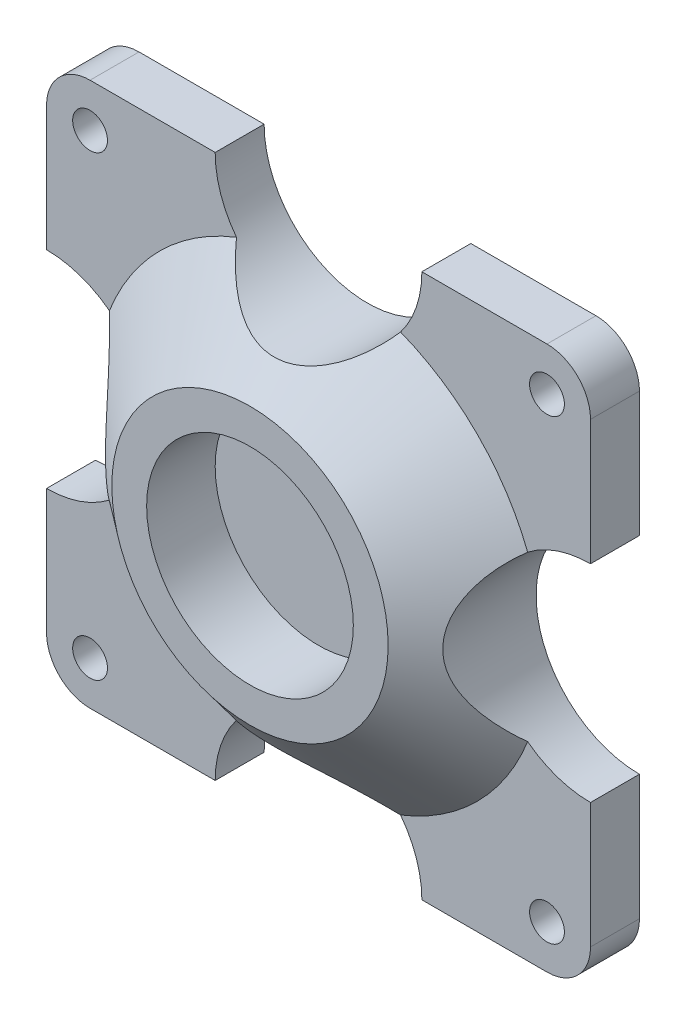
from build123d import *

# Parameters (mm, degrees)
BOSS_EXTRUDE1_DEPTH     = 4.5
SKETCH2_R               = 41.3
SKETCH3_R               = 25.4
SKETCH4_R               = 19
CUT_EXTRUDE1_DEPTH      = 12.6
SKETCH5_R               = 3.2
CUT_EXTRUDE2_DEPTH      = 9
CUT_EXTRUDE3_DEPTH      = 72.824508369
CUT_EXTRUDE3_DEPTH_BACK = 72.824508369
CUT_EXTRUDE4_DEPTH      = 72.824508439


with BuildPart() as part:
    # Sketch1 → Boss-Extrude1 (new, symmetric)
    with BuildSketch(Plane.XY):
        with BuildLine():
            Line((-42, 50), (42, 50))
            ThreePointArc((42, 50), (47.656854249, 47.656854249), (50, 42))
            Line((50, 42), (50, -42))
            ThreePointArc((50, -42), (47.656854249, -47.656854249), (42, -50))
            Line((42, -50), (-42, -50))
            ThreePointArc((-42, -50), (-47.656854249, -47.656854249), (-50, -42))
            Line((-50, -42), (-50, 42))
            ThreePointArc((-50, 42), (-47.656854249, 47.656854249), (-42, 50))
        make_face()
    extrude(amount=BOSS_EXTRUDE1_DEPTH, both=True)

    # Sketch2 → Loft1 section 0
    with BuildSketch(Plane.XY.offset(4.5)):
        Circle(SKETCH2_R)
    # Sketch3 → Loft1 section 1
    with BuildSketch(Plane.XY.offset(17.1)):
        Circle(SKETCH3_R)
    loft()

    # Sketch4 → Cut-Extrude1 (cut)
    with BuildSketch(Plane.XY.offset(17.1)):
        Circle(SKETCH4_R)
    extrude(amount=-CUT_EXTRUDE1_DEPTH, mode=Mode.SUBTRACT)

    # Sketch5 → Cut-Extrude2 (cut)
    with BuildSketch(Plane.XY.offset(4.5)):
        with Locations((-42, 42)):
            Circle(SKETCH5_R)
        with Locations((42, 42)):
            Circle(SKETCH5_R)
    cut_extrude2 = extrude(amount=-CUT_EXTRUDE2_DEPTH, mode=Mode.SUBTRACT)

    # Mirror1: Cut-Extrude2 across plane
    add(cut_extrude2.mirror(Plane.ZX), mode=Mode.SUBTRACT)

    # Sketch6 → Cut-Extrude3 (cut, two sides: drawn at the far end of the back side and taken through both)
    with BuildSketch(Plane.XY.offset(4.5).offset(-CUT_EXTRUDE3_DEPTH_BACK)):
        with BuildLine():
            Line((-19, -50), (19, -50))
            ThreePointArc((19, -50), (0, -31), (-19, -50))
        make_face()
        with BuildLine():
            Line((-19, 50), (19, 50))
            ThreePointArc((19, 50), (0, 31), (-19, 50))
        make_face()
    extrude(amount=CUT_EXTRUDE3_DEPTH + CUT_EXTRUDE3_DEPTH_BACK, mode=Mode.SUBTRACT)

    # Sketch8 → Cut-Extrude4 (cut, symmetric)
    with BuildSketch(Plane.XY.offset(4.5)):
        with BuildLine():
            Line((50, 19), (50, -19))
            ThreePointArc((50, -19), (31, 0), (50, 19))
        make_face()
    cut_extrude4 = extrude(amount=CUT_EXTRUDE4_DEPTH, both=True, mode=Mode.SUBTRACT)

    # Mirror3: Cut-Extrude4 across plane
    add(cut_extrude4.mirror(Plane(origin=(0, 0, 0), x_dir=(0, 0, 1), z_dir=(1, 0, 0))), mode=Mode.SUBTRACT)


solid = part.part
